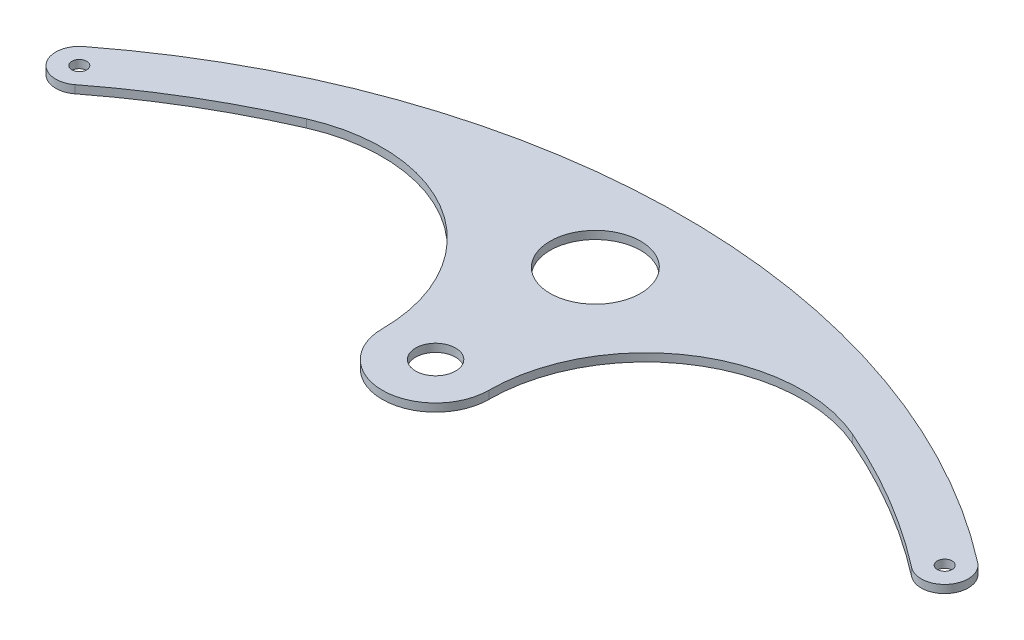
from build123d import *

# Parameters (mm, degrees)
SKETCH1_R           = 1.778
SKETCH1_R_2         = 4.7625
SKETCH1_R_3         = 10.795
BOSS_EXTRUDE1_DEPTH = 1.905


with BuildPart() as part:
    # Sketch1 → Boss-Extrude1 (new body)
    with BuildSketch(Plane(origin=(0, 0, 0), x_dir=(1, 0, 0), z_dir=(0, 1, 0))):
        with BuildLine():
            ThreePointArc((-3.434964073, 4.439030494), (-4.439030494, -3.434964073), (3.434964073, -4.439030494))
            ThreePointArc((3.434964073, -4.439030494), (20.136115591, 6.903606124), (38.111342378, 16.094639222))
            ThreePointArc((38.111342378, 16.094639222), (73.570878275, 13.084704733), (90.4875, -18.2245))
            ThreePointArc((90.4875, -18.2245), (103.1875, -30.9245), (115.8875, -18.2245))
            ThreePointArc((115.8875, -18.2245), (132.804121725, 13.084704733), (168.263657622, 16.094639222))
            ThreePointArc((168.263657622, 16.094639222), (186.238884409, 6.903606124), (202.940035927, -4.439030494))
            ThreePointArc((202.940035927, -4.439030494), (210.814030494, -3.434964073), (209.809964073, 4.439030494))
            ThreePointArc((209.809964073, 4.439030494), (103.1875, 40.874472361), (-3.434964073, 4.439030494))
        make_face()
        with Locations(Location((0, 0, 0), (0, 0, 90))):
            Circle(SKETCH1_R, mode=Mode.SUBTRACT)
        with Locations(Location((206.375, 0, 0), (0, 0, 90))):
            Circle(SKETCH1_R, mode=Mode.SUBTRACT)
        with Locations(Location((103.1875, -18.2245, 0), (0, 0, 90))):
            Circle(SKETCH1_R_2, mode=Mode.SUBTRACT)
        with Locations(Location((103.1875, 19.8755, 0), (0, 0, 90))):
            Circle(SKETCH1_R_3, mode=Mode.SUBTRACT)
    extrude(amount=BOSS_EXTRUDE1_DEPTH)


solid = part.part
